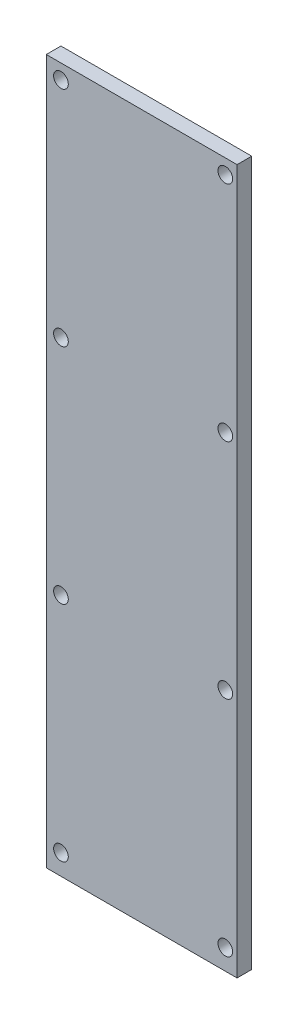
from build123d import *

# Parameters (mm, degrees)
SKETCH1_W                 = 82.55
SKETCH1_H                 = 6.35
BOSS_EXTRUDE1_DEPTH       = 304.8
SKETCH2_R                 = 3.175
CUT_EXTRUDE1_DEPTH        = 152.4
LPATTERN1_COUNT           = 4
LPATTERN1_PITCH           = 96.52
LPATTERN2_COUNT           = 2
LPATTERN2_PITCH           = 71.12
LPATTERN2_COPY_1_SKETCH_R = 3.175
LPATTERN2_COPY_1_DEPTH    = 152.4
LPATTERN2_COPY_2_SKETCH_R = 3.175
LPATTERN2_COPY_2_DEPTH    = 152.4
LPATTERN2_COPY_3_SKETCH_R = 3.175
LPATTERN2_COPY_3_DEPTH    = 152.4


with BuildPart() as part:
    # Sketch1 → Boss-Extrude1 (new body)
    with BuildSketch(Plane(origin=(0, 0, 0), x_dir=(1, 0, 0), z_dir=(0, 1, 0))):
        with Locations((-7.093085106, 27.426595745)):
            Rectangle(SKETCH1_W, SKETCH1_H)
    extrude(amount=BOSS_EXTRUDE1_DEPTH)

    # Sketch2 → Cut-Extrude1 (cut)
    with BuildSketch(Plane.XY.offset(-24.251595745)):
        with Locations((-42.018085106, 298.45)):
            Circle(SKETCH2_R)
    cut_extrude1 = extrude(amount=-CUT_EXTRUDE1_DEPTH, mode=Mode.SUBTRACT)

    # LPattern1: Cut-Extrude1 ×4
    with Locations(*[(0, -i * LPATTERN1_PITCH, 0) for i in range(1, LPATTERN1_COUNT)]):
        add(cut_extrude1, mode=Mode.SUBTRACT)

    # LPattern2: Cut-Extrude1 ×2
    with Locations(*[(i * LPATTERN2_PITCH, 0, 0) for i in range(1, LPATTERN2_COUNT)]):
        add(cut_extrude1, mode=Mode.SUBTRACT)

    # LPattern2 copy 1 sketch → LPattern2 copy 1 (cut)
    with BuildSketch(Plane(origin=(71.12, -96.52, -24.251595745), x_dir=(1, 0, 0), z_dir=(0, 0, 1))):
        with Locations((-42.018085106, 298.45)):
            Circle(LPATTERN2_COPY_1_SKETCH_R)
    extrude(amount=-LPATTERN2_COPY_1_DEPTH, mode=Mode.SUBTRACT)

    # LPattern2 copy 2 sketch → LPattern2 copy 2 (cut)
    with BuildSketch(Plane(origin=(71.12, -193.04, -24.251595745), x_dir=(1, 0, 0), z_dir=(0, 0, 1))):
        with Locations((-42.018085106, 298.45)):
            Circle(LPATTERN2_COPY_2_SKETCH_R)
    extrude(amount=-LPATTERN2_COPY_2_DEPTH, mode=Mode.SUBTRACT)

    # LPattern2 copy 3 sketch → LPattern2 copy 3 (cut)
    with BuildSketch(Plane(origin=(71.12, -289.56, -24.251595745), x_dir=(1, 0, 0), z_dir=(0, 0, 1))):
        with Locations((-42.018085106, 298.45)):
            Circle(LPATTERN2_COPY_3_SKETCH_R)
    extrude(amount=-LPATTERN2_COPY_3_DEPTH, mode=Mode.SUBTRACT)


solid = part.part
